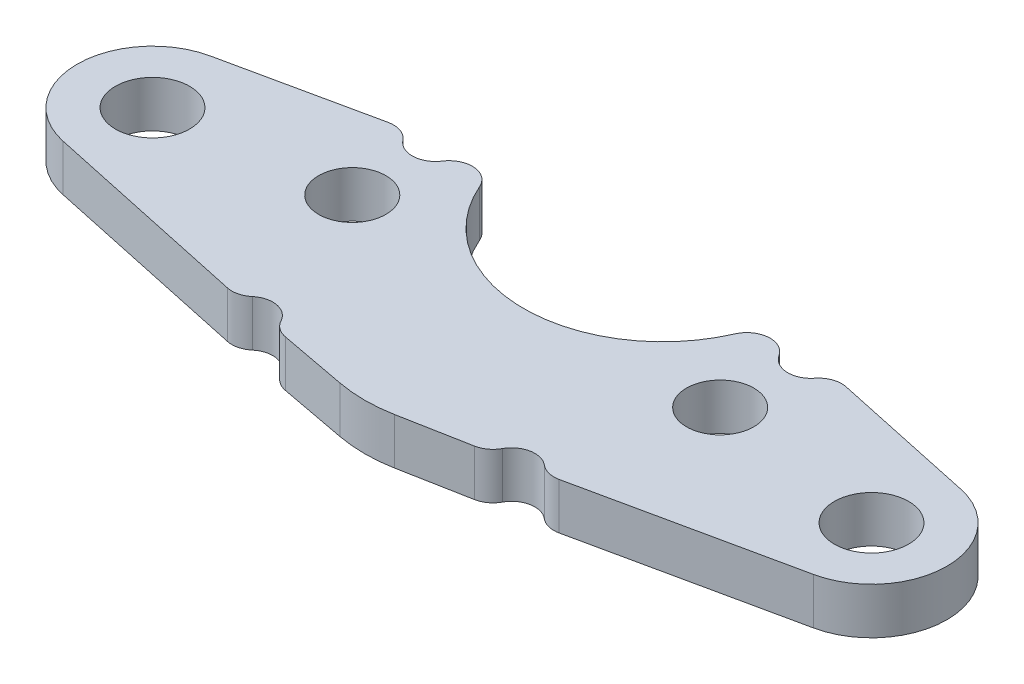
from build123d import *

# Parameters (mm, degrees)
SKETCH1_R           = 1.599999998
SKETCH1_R_2         = 1.45
BOSS_EXTRUDE1_DEPTH = 2


with BuildPart() as part:
    # Sketch1 → Boss-Extrude1 (new body)
    with BuildSketch(Plane.XZ):
        with BuildLine():
            Line((16.181421483, -3.177760966), (9.872858324, -4.530534353))
            ThreePointArc((9.872858324, -4.530534353), (9.325880949, -4.494155653), (8.88026758, -4.174880875))
            ThreePointArc((8.88026758, -4.174880875), (8.049335418, -3.798153126), (7.258365077, -4.252837604))
            ThreePointArc((7.258365077, -4.252837604), (6.336866412, -4.705264718), (5.502330147, -4.107435892))
            ThreePointArc((5.502330147, -4.107435892), (0, -0.499999997), (-5.502330147, -4.107435892))
            ThreePointArc((-5.502330147, -4.107435892), (-6.336866412, -4.705264718), (-7.258365077, -4.252837604))
            ThreePointArc((-7.258365077, -4.252837604), (-8.049335418, -3.798153126), (-8.88026758, -4.174880875))
            ThreePointArc((-8.88026758, -4.174880875), (-9.325880949, -4.494155653), (-9.872858324, -4.530534353))
            Line((-9.872858324, -4.530534353), (-16.181421483, -3.177760966))
            ThreePointArc((-16.181421483, -3.177760966), (-18.749999999, 0), (-16.181421483, 3.177760966))
            Line((-16.181421483, 3.177760966), (-7.150681086, 5.114262981))
            ThreePointArc((-7.150681086, 5.114262981), (-6.698238018, 5.106573021), (-6.295506482, 4.900245189))
            ThreePointArc((-6.295506482, 4.900245189), (-5.464959808, 4.681269053), (-4.770928095, 5.187310858))
            ThreePointArc((-4.770928095, 5.187310858), (-4.48101085, 5.518641983), (-4.076896383, 5.693352662))
            Line((-4.076896383, 5.693352662), (-1.17489874, 6.239775137))
            ThreePointArc((-1.17489874, 6.239775137), (0, 6.34942366), (1.17489874, 6.239775137))
            Line((1.17489874, 6.239775137), (4.076896383, 5.693352662))
            ThreePointArc((4.076896383, 5.693352662), (4.48101085, 5.518641983), (4.770928095, 5.187310858))
            ThreePointArc((4.770928095, 5.187310858), (5.464959808, 4.681269053), (6.295506482, 4.900245189))
            ThreePointArc((6.295506482, 4.900245189), (6.698238018, 5.106573021), (7.150681086, 5.114262981))
            Line((7.150681086, 5.114262981), (16.181421483, 3.177760966))
            ThreePointArc((16.181421483, 3.177760966), (18.749999999, 0), (16.181421483, -3.177760966))
        make_face()
        with Locations(Location((-15.5, 0, 0), (0, 0, 90))):
            Circle(SKETCH1_R, mode=Mode.SUBTRACT)
        with Locations(Location((15.5, 0, 0), (0, 0, 270))):
            Circle(SKETCH1_R, mode=Mode.SUBTRACT)
        with Locations(Location((7.931558887, -1.04420954, 0), (0, 0, 270))):
            Circle(SKETCH1_R_2, mode=Mode.SUBTRACT)
        with Locations(Location((-7.931558887, -1.04420954, 0), (0, 0, 90))):
            Circle(SKETCH1_R_2, mode=Mode.SUBTRACT)
    extrude(amount=-BOSS_EXTRUDE1_DEPTH)


solid = part.part
